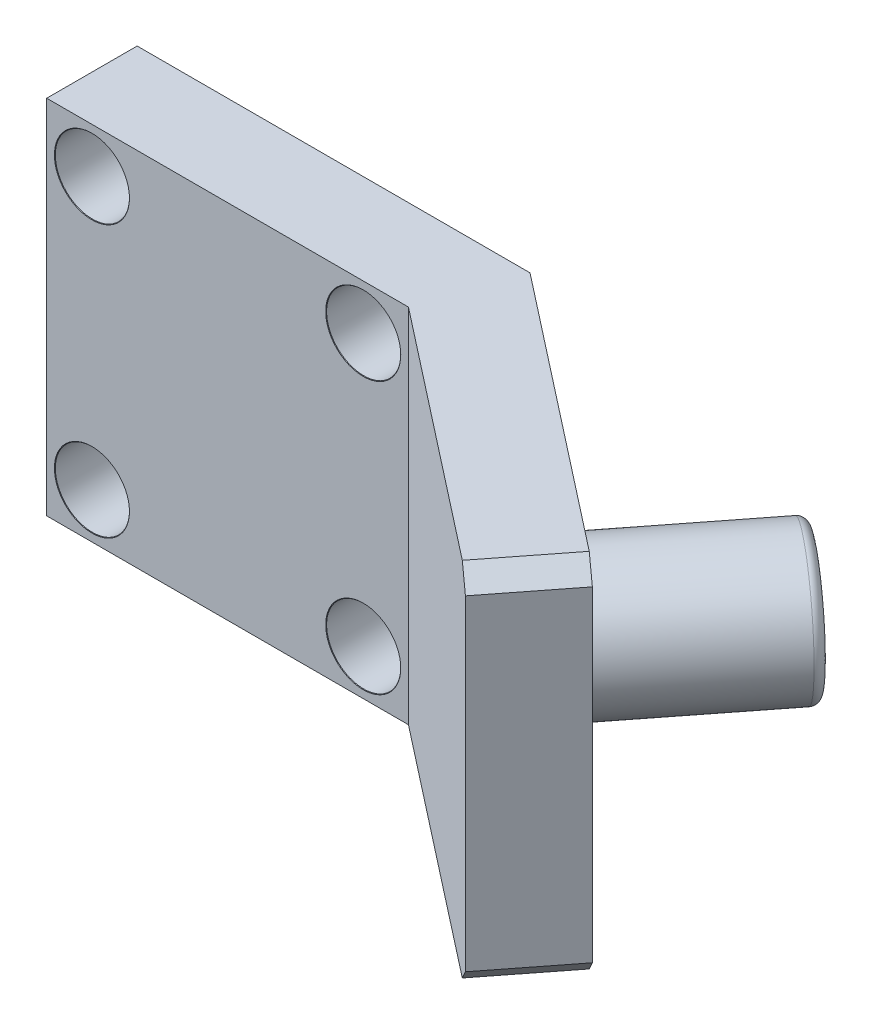
from build123d import *

# Parameters (mm, degrees)
EXTRUDE_1_DEPTH                   = 10
HOLE_WIZARD_4_1_4_1_1_D           = 4.1
HOLE_WIZARD_4_1_4_1_1_CSINK_D     = 4.15
HOLE_WIZARD_4_1_4_1_1_CSINK_ANGLE = 90
SKETCH_4_R                        = 3.75
EXTRUDE_2_DEPTH                   = 10
FILLET_1_R                        = 0.5
CHAMFER_1_SIZE                    = 1


with BuildPart() as part:
    # 草图1 → 凸台-拉伸1 (new, symmetric)
    with BuildSketch(Plane(origin=(0, 0, 0), x_dir=(1, 0, 0), z_dir=(0, 1, 0))):
        Polygon((0, 0), (-21.721638066, 0), (-21.721638066, -5), (-1.721638066, -5), (12.681907696, -16.253283275), (15.760215072, -12.313229507), align=None)
    extrude(amount=EXTRUDE_1_DEPTH, both=True)

    # Ø4.1 (4.1) 直径孔1 (through all)
    with Locations(Plane(origin=(-19.221638066, 7.5, 5), x_dir=(1, 0, 0), z_dir=(0, 0, 1))):
        with Locations((0, 0), (15, 0), (15, -15), (0, -15)):
            CounterSinkHole(HOLE_WIZARD_4_1_4_1_1_D / 2, HOLE_WIZARD_4_1_4_1_1_CSINK_D / 2, counter_sink_angle=HOLE_WIZARD_4_1_4_1_1_CSINK_ANGLE)

    # 草图4 → 凸台-拉伸2 (add)
    with BuildSketch(Plane(origin=(0, 0, 0), x_dir=(-0.7880107536067258, 0, -0.6156614753256534), z_dir=(0.6156614753256534, 0, -0.7880107536067258))):
        with Locations(Location((-10, 0, 0), (0, 0, 180))):
            Circle(SKETCH_4_R)
    extrude(amount=EXTRUDE_2_DEPTH)

    # 圆角1
    fillet_1_edges = [part.edges().sort_by_distance(p)[0] for p in [
        (11.081681963, 0, -4.032223315),
    ]]
    fillet(fillet_1_edges, radius=FILLET_1_R)

    # 倒角1
    chamfer_1_edges = [part.edges().sort_by_distance(p)[0] for p in [
        (14.221061384, 10, 14.283256391),
        (14.221061384, -10, 14.283256391),
    ]]
    chamfer(chamfer_1_edges, length=CHAMFER_1_SIZE)


solid = part.part
